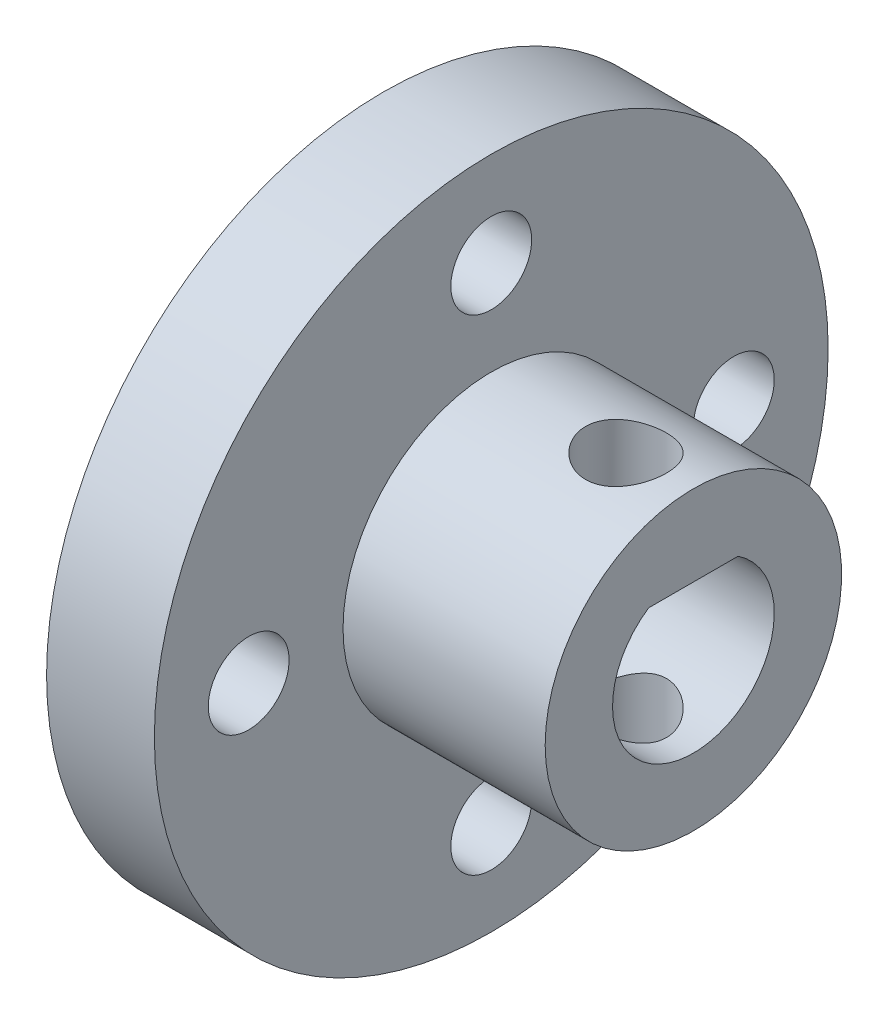
from build123d import *

# Parameters (mm, degrees)
CUT_EXTRUDE_1_REACH = 23.089
SKETCH_7_R          = 1.5
CUT_EXTRUDE_2_DEPTH = 16
CUT_EXTRUDE_3_REACH = 23.089
SKETCH_8_R          = 1.5


with BuildPart() as part:
    # 草图4 → 旋转1 (revolve)
    with BuildSketch(Plane.XY, mode=Mode.PRIVATE) as revolve_1_sk:
        Polygon((0, 0), (0, 12.5), (4, 12.5), (4, 5.5), (11.5, 5.5), (11.5, 0), align=None)
    revolve(revolve_1_sk.sketch.rotate(Axis((0, 0, 0), (1, 0, 0)), 90), axis=Axis((0, 0, 0), (1, 0, 0)))

    # 草图5 → 切除-拉伸1 (cut, up to next)
    with BuildSketch(Plane(origin=(11.5, 0, 0), x_dir=(0, 0, -1), z_dir=(1, 0, 0)), mode=Mode.PRIVATE) as cut_extrude_1_sk1:
        with BuildLine():
            Line((-1.658312395, 2.5), (1.658312395, 2.5))
            ThreePointArc((1.658312395, 2.5), (0, -3), (-1.658312395, 2.5))
        make_face()
    cut_extrude_1_tool1 = extrude(cut_extrude_1_sk1.sketch, amount=-CUT_EXTRUDE_1_REACH, mode=Mode.PRIVATE) & part.part
    add(cut_extrude_1_tool1.solids().sort_by_distance((11.5, -0.111984, 0))[0], mode=Mode.SUBTRACT)

    # 草图7 → 切除-拉伸2 (cut)
    with BuildSketch(Plane(origin=(0, 6.5, 0), x_dir=(1, 0, 0), z_dir=(0, 1, 0))):
        with Locations(Location((9, 0, 0), (0, 0, 270))):
            Circle(SKETCH_7_R)
    extrude(amount=-CUT_EXTRUDE_2_DEPTH, mode=Mode.SUBTRACT)

    # 草图8 → 切除-拉伸3 (cut, up to next)
    with BuildSketch(Plane.ZY, mode=Mode.PRIVATE) as cut_extrude_3_sk1:
        with Locations((9, 0)):
            Circle(SKETCH_8_R)
    cut_extrude_3_tool1 = extrude(cut_extrude_3_sk1.sketch, amount=-CUT_EXTRUDE_3_REACH, mode=Mode.PRIVATE) & part.part
    # 草图8 → 切除-拉伸3 (cut, up to next)
    with BuildSketch(Plane.ZY, mode=Mode.PRIVATE) as cut_extrude_3_sk2:
        with Locations((0, -9)):
            Circle(SKETCH_8_R)
    cut_extrude_3_tool2 = extrude(cut_extrude_3_sk2.sketch, amount=-CUT_EXTRUDE_3_REACH, mode=Mode.PRIVATE) & part.part
    # 草图8 → 切除-拉伸3 (cut, up to next)
    with BuildSketch(Plane.ZY, mode=Mode.PRIVATE) as cut_extrude_3_sk3:
        with Locations((-9, 0)):
            Circle(SKETCH_8_R)
    cut_extrude_3_tool3 = extrude(cut_extrude_3_sk3.sketch, amount=-CUT_EXTRUDE_3_REACH, mode=Mode.PRIVATE) & part.part
    # 草图8 → 切除-拉伸3 (cut, up to next)
    with BuildSketch(Plane.ZY, mode=Mode.PRIVATE) as cut_extrude_3_sk4:
        with Locations((0, 9)):
            Circle(SKETCH_8_R)
    cut_extrude_3_tool4 = extrude(cut_extrude_3_sk4.sketch, amount=-CUT_EXTRUDE_3_REACH, mode=Mode.PRIVATE) & part.part
    add(cut_extrude_3_tool1.solids().sort_by_distance((0, 0, 9))[0], mode=Mode.SUBTRACT)
    add(cut_extrude_3_tool2.solids().sort_by_distance((0, -9, 0))[0], mode=Mode.SUBTRACT)
    add(cut_extrude_3_tool3.solids().sort_by_distance((0, 0, -9))[0], mode=Mode.SUBTRACT)
    add(cut_extrude_3_tool4.solids().sort_by_distance((0, 9, 0))[0], mode=Mode.SUBTRACT)


solid = part.part
